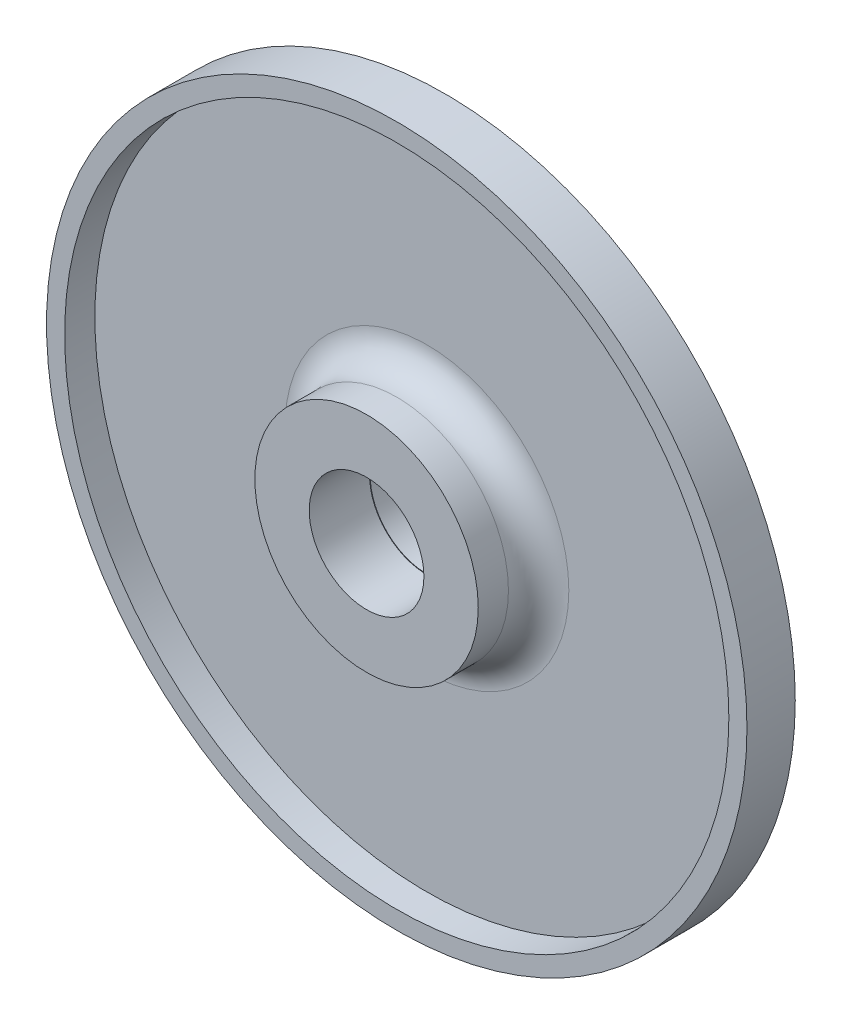
from build123d import *

# Parameters (mm, degrees)
SKETCH1_R           = 58
BOSS_EXTRUDE1_DEPTH = 8
SKETCH2_R           = 55
CUT_EXTRUDE1_DEPTH  = 5
SKETCH3_R           = 18.5
SKETCH3_R_2         = 9.5
BOSS_EXTRUDE2_DEPTH = 10
FILLET1_R           = 5
SKETCH4_R           = 13.315
SKETCH4_R_2         = 9.4
BOSS_EXTRUDE3_DEPTH = 17
CUT_EXTRUDE2_START  = -17
SKETCH5_R           = 9.4
CUT_EXTRUDE2_DEPTH  = 17


with BuildPart() as part:
    # Sketch1 → Boss-Extrude1 (new body)
    with BuildSketch(Plane.XY):
        Circle(SKETCH1_R)
    extrude(amount=BOSS_EXTRUDE1_DEPTH)

    # Sketch2 → Cut-Extrude1 (cut)
    with BuildSketch(Plane.XY.offset(8)):
        Circle(SKETCH2_R)
    extrude(amount=-CUT_EXTRUDE1_DEPTH, mode=Mode.SUBTRACT)

    # Sketch3 → Boss-Extrude2 (add)
    with BuildSketch(Plane.XY.offset(3)):
        Circle(SKETCH3_R)
        Circle(SKETCH3_R_2, mode=Mode.SUBTRACT)
    extrude(amount=BOSS_EXTRUDE2_DEPTH)

    # Fillet1
    fillet1_edges = [part.edges().sort_by_distance(p)[0] for p in [
        (-18.5, 0, 3),
    ]]
    fillet(fillet1_edges, radius=FILLET1_R)

    # Sketch4 → Boss-Extrude3 (add)
    with BuildSketch(Plane(origin=(0, 0, 0), x_dir=(-1, 0, 0), z_dir=(0, 0, -1))):
        with Locations(Location((0, 0, 0), (0, 0, 180))):
            Circle(SKETCH4_R)
        Circle(SKETCH4_R_2, mode=Mode.SUBTRACT)
    extrude(amount=BOSS_EXTRUDE3_DEPTH)

    # Sketch5 → Cut-Extrude2 (cut)
    with BuildSketch(Plane(origin=(0, 0, 0), x_dir=(-1, 0, 0), z_dir=(0, 0, -1)).offset(CUT_EXTRUDE2_START)):
        with Locations(Location((0, 0, 0), (0, 0, 180))):
            Circle(SKETCH5_R)
    extrude(amount=CUT_EXTRUDE2_DEPTH, mode=Mode.SUBTRACT)


solid = part.part
